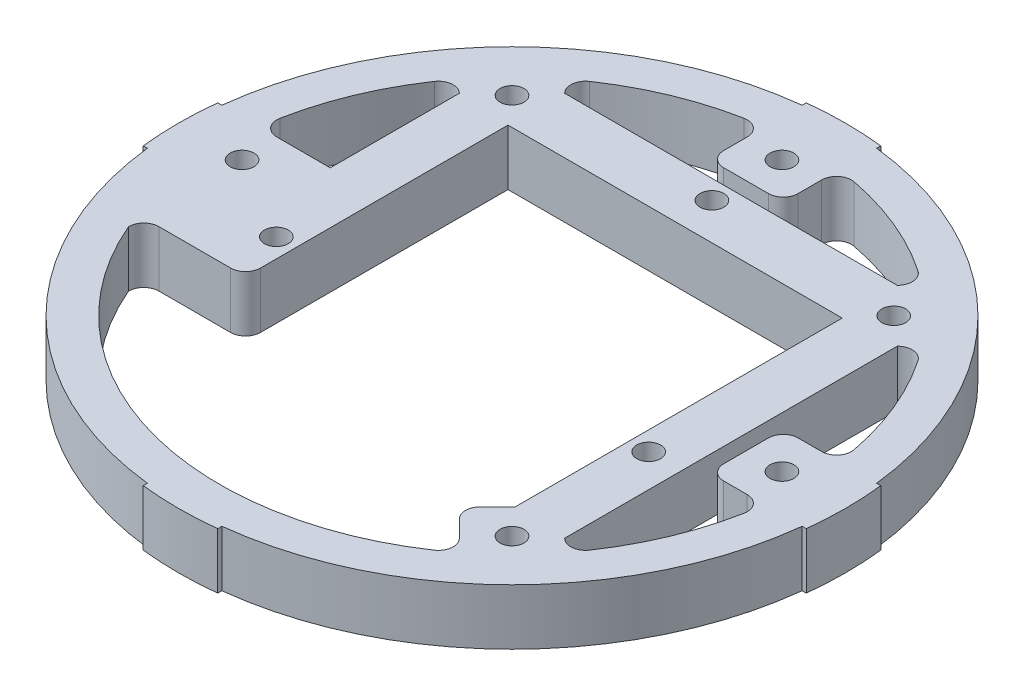
from build123d import *

# Parameters (mm, degrees)
SKETCH2_R           = 1.6
BOSS_EXTRUDE2_DEPTH = 7.5
SKETCH3_R           = 1.6
BOSS_EXTRUDE3_DEPTH = 7.5


with BuildPart() as part:
    # Sketch2 → Boss-Extrude2 (new body)
    with BuildSketch(Plane(origin=(0, 0, 0), x_dir=(1, 0, 0), z_dir=(0, 1, 0))):
        with BuildLine():
            Line((43.966606646, 5), (44.520107816, 5))
            ThreePointArc((44.520107816, 5), (44.8, 0), (44.520107816, -5))
            Line((44.520107816, -5), (43.966606646, -5))
            ThreePointArc((43.966606646, -5), (31.289475067, -31.289475068), (5, -43.966606646))
            Line((5, -43.966606646), (5, -44.520107816))
            ThreePointArc((5, -44.520107816), (0, -44.8), (-5, -44.520107816))
            Line((-5, -44.520107816), (-5, -43.966606646))
            ThreePointArc((-5, -43.966606646), (-31.289475068, -31.289475067), (-43.966606646, -5))
            Line((-43.966606646, -5), (-44.520107816, -5))
            ThreePointArc((-44.520107816, -5), (-44.8, 0), (-44.520107816, 5))
            Line((-44.520107816, 5), (-43.966606646, 5))
            ThreePointArc((-43.966606646, 5), (-31.289475067, 31.289475068), (-5, 43.966606646))
            Line((-5, 43.966606646), (-5, 44.520107816))
            ThreePointArc((-5, 44.520107816), (0, 44.8), (5, 44.520107816))
            Line((5, 44.520107816), (5, 43.966606646))
            ThreePointArc((5, 43.966606646), (31.289475068, 31.289475067), (43.966606646, 5))
        make_face()
        with Locations(Location((36.25, 0, 0), (0, 0, 270))):
            Circle(SKETCH2_R, mode=Mode.SUBTRACT)
        with Locations(Location((25.632620818, -25.632620818, 0), (0, 0, 270))):
            Circle(SKETCH2_R, mode=Mode.SUBTRACT)
        with Locations(Location((-36.25, 0, 0), (0, 0, 270))):
            Circle(SKETCH2_R, mode=Mode.SUBTRACT)
        with Locations(Location((-25.632620818, 25.632620818, 0), (0, 0, 270))):
            Circle(SKETCH2_R, mode=Mode.SUBTRACT)
        with Locations(Location((0, 36.25, 0), (0, 0, 270))):
            Circle(SKETCH2_R, mode=Mode.SUBTRACT)
        with Locations(Location((25.632620818, 25.632620818, 0), (0, 0, 270))):
            Circle(SKETCH2_R, mode=Mode.SUBTRACT)
        with BuildLine():
            Line((31.43, 3), (31.43, -3))
            ThreePointArc((31.43, -3), (32.015786437, -4.414213563), (33.43, -5))
            Line((33.43, -5), (36.58614437, -5))
            ThreePointArc((36.58614437, -5), (38.127674053, -5.725487102), (38.550739297, -7.375838913))
            ThreePointArc((38.550739297, -7.375838913), (36.262271651, -15.02032472), (32.474994889, -22.043983464))
            ThreePointArc((32.474994889, -22.043983464), (31.00886763, -22.911806118), (29.405844687, -22.334776876))
            Line((29.405844687, -22.334776876), (27.174113601, -20.103045789))
            ThreePointArc((27.174113601, -20.103045789), (25.759900039, -19.517259351), (24.345686476, -20.103045789))
            Line((24.345686476, -20.103045789), (20.103045789, -24.345686476))
            ThreePointArc((20.103045789, -24.345686476), (19.517259351, -25.759900039), (20.103045789, -27.174113601))
            Line((20.103045789, -27.174113601), (22.334776875, -29.405844688))
            ThreePointArc((22.334776875, -29.405844688), (22.911806119, -31.00886763), (22.043983464, -32.474994889))
            ThreePointArc((22.043983464, -32.474994889), (-15.02032472, -36.262271651), (-38.550739297, -7.375838914))
            ThreePointArc((-38.550739297, -7.375838914), (-38.127674054, -5.725487102), (-36.58614437, -5))
            Line((-36.58614437, -5), (-33.43, -5))
            ThreePointArc((-33.43, -5), (-32.015786438, -4.414213562), (-31.43, -3))
            Line((-31.43, -3), (-31.43, 3))
            ThreePointArc((-31.43, 3), (-32.015786437, 4.414213563), (-33.43, 5))
            Line((-33.43, 5), (-36.58614437, 5))
            ThreePointArc((-36.58614437, 5), (-38.127674053, 5.725487102), (-38.550739297, 7.375838913))
            ThreePointArc((-38.550739297, 7.375838913), (-36.262271651, 15.02032472), (-32.474994889, 22.043983464))
            ThreePointArc((-32.474994889, 22.043983464), (-31.00886763, 22.911806118), (-29.405844687, 22.334776876))
            Line((-29.405844687, 22.334776876), (-27.174113601, 20.103045789))
            ThreePointArc((-27.174113601, 20.103045789), (-25.759900039, 19.517259351), (-24.345686476, 20.103045789))
            Line((-24.345686476, 20.103045789), (-20.103045789, 24.345686476))
            ThreePointArc((-20.103045789, 24.345686476), (-19.517259351, 25.759900039), (-20.103045789, 27.174113601))
            Line((-20.103045789, 27.174113601), (-22.334776875, 29.405844688))
            ThreePointArc((-22.334776875, 29.405844688), (-22.911806119, 31.00886763), (-22.043983464, 32.474994889))
            ThreePointArc((-22.043983464, 32.474994889), (-15.020324721, 36.262271651), (-7.375838914, 38.550739297))
            ThreePointArc((-7.375838914, 38.550739297), (-5.725487102, 38.127674054), (-5, 36.58614437))
            Line((-5, 36.58614437), (-5, 33.43))
            ThreePointArc((-5, 33.43), (-4.414213562, 32.015786438), (-3, 31.43))
            Line((-3, 31.43), (3, 31.43))
            ThreePointArc((3, 31.43), (4.414213563, 32.015786437), (5, 33.43))
            Line((5, 33.43), (5, 36.58614437))
            ThreePointArc((5, 36.58614437), (5.725487102, 38.127674053), (7.375838913, 38.550739297))
            ThreePointArc((7.375838913, 38.550739297), (15.02032472, 36.262271651), (22.043983464, 32.474994889))
            ThreePointArc((22.043983464, 32.474994889), (22.911806118, 31.00886763), (22.334776876, 29.405844687))
            Line((22.334776876, 29.405844687), (20.103045789, 27.174113601))
            ThreePointArc((20.103045789, 27.174113601), (19.517259351, 25.759900039), (20.103045789, 24.345686476))
            Line((20.103045789, 24.345686476), (24.345686476, 20.103045789))
            ThreePointArc((24.345686476, 20.103045789), (25.759900039, 19.517259351), (27.174113601, 20.103045789))
            Line((27.174113601, 20.103045789), (29.405844688, 22.334776875))
            ThreePointArc((29.405844688, 22.334776875), (31.00886763, 22.911806119), (32.474994889, 22.043983464))
            ThreePointArc((32.474994889, 22.043983464), (36.262271651, 15.020324721), (38.550739297, 7.375838914))
            ThreePointArc((38.550739297, 7.375838914), (38.127674054, 5.725487102), (36.58614437, 5))
            Line((36.58614437, 5), (33.43, 5))
            ThreePointArc((33.43, 5), (32.015786438, 4.414213562), (31.43, 3))
        make_face(mode=Mode.SUBTRACT)
    extrude(amount=BOSS_EXTRUDE2_DEPTH)

    # Sketch3 → Boss-Extrude3 (add)
    with BuildSketch(Plane.XZ):
        with BuildLine():
            Line((22.440941356, -21.901962064), (-22.440941356, -21.901962064))
            Line((-22.440941356, -21.901962064), (-22.440941356, 6.65))
            Line((-22.440941356, 6.65), (-22.440941356, 11.341310409))
            ThreePointArc((-22.440941356, 11.341310409), (-23.026727793, 12.755523971), (-24.440941356, 13.341310409))
            Line((-24.440941356, 13.341310409), (-29.405844687, 13.341310409))
            Line((-29.405844687, 13.341310409), (-34.091425962, 13.341310409))
            ThreePointArc((-34.091425962, 13.341310409), (-35.536566009, 13.956827134), (-36.091425962, 15.426323995))
            Line((-36.091425962, 15.426323995), (-39.579540156, 15.426323995))
            Line((-39.579540156, 15.426323995), (-39.579540156, 13.341310409))
            Line((-39.579540156, 13.341310409), (-39.579540156, 3.405536176))
            Line((-39.579540156, 3.405536176), (-33.43, 3.405536176))
            Line((-33.43, 3.405536176), (-33.43, -5))
            Line((-33.43, -5), (-29.405844687, -5))
            Line((-29.405844687, -5), (-29.405844687, -22.334776876))
            Line((-29.405844687, -22.334776876), (-29.405844687, -29.405844688))
            Line((-29.405844687, -29.405844688), (-22.334776875, -29.405844688))
            Line((-22.334776875, -29.405844688), (22.334776876, -29.405844687))
            Line((22.334776876, -29.405844687), (29.405844688, -29.405844688))
            Line((29.405844688, -29.405844688), (29.405844688, -22.334776875))
            Line((29.405844688, -22.334776875), (29.405844687, 22.334776876))
            Line((29.405844687, 22.334776876), (29.405844688, 29.405844687))
            Line((29.405844688, 29.405844687), (23.434556913, 29.405844687))
            Line((23.434556913, 29.405844687), (23.434556913, 25.632620817))
            Line((23.434556913, 25.632620817), (22.440941356, 25.632620817))
            Line((22.440941356, 25.632620817), (22.440941356, 24.032620818))
            Line((22.440941356, 24.032620818), (22.440941356, -21.901962064))
        make_face()
        with Locations(Location((0, -26.847695671, 0), (0, 0, 270))):
            Circle(SKETCH3_R, mode=Mode.SUBTRACT)
        with Locations(Location((-25, 6.65, 0), (0, 0, 270))):
            Circle(SKETCH3_R, mode=Mode.SUBTRACT)
        with Locations(Location((25, 6.65, 0), (0, 0, 270))):
            Circle(SKETCH3_R, mode=Mode.SUBTRACT)
        with Locations(Location((25.632620818, 25.632620818, 0), (0, 0, 90))):
            Circle(SKETCH3_R, mode=Mode.SUBTRACT)
        with Locations(Location((-25.632620818, -25.632620818, 0), (0, 0, 90))):
            Circle(SKETCH3_R, mode=Mode.SUBTRACT)
        with Locations(Location((25.632620818, -25.632620818, 0), (0, 0, 90))):
            Circle(SKETCH3_R, mode=Mode.SUBTRACT)
    extrude(amount=-BOSS_EXTRUDE3_DEPTH)


solid = part.part
